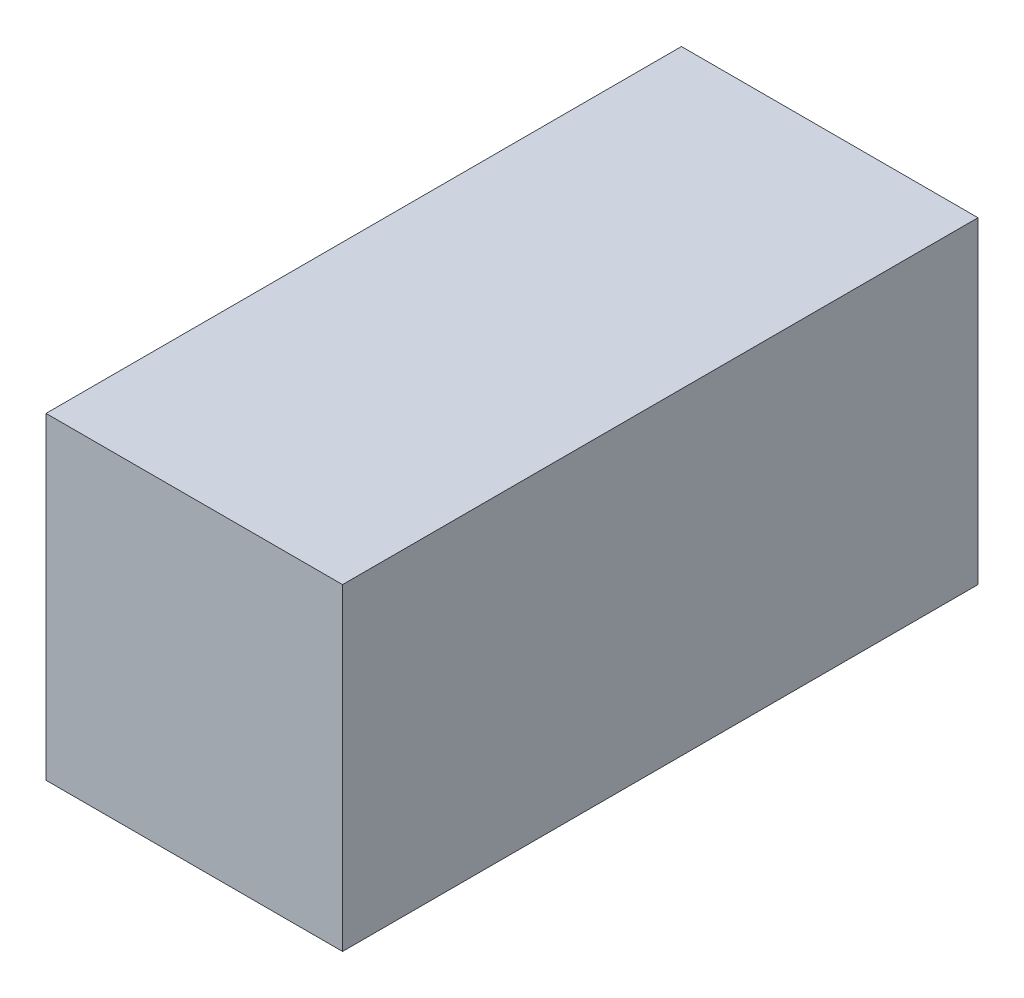
from build123d import *

# Parameters (mm, degrees)
STORE_KLAPE_KASET_KATI_DONMUS_KAP_4_1_START = -100
SKETCH1_W                                   = 140
SKETCH1_H                                   = 150
STORE_KLAPE_KASET_KATI_DONMUS_KAP_4_1_DEPTH = 300


with BuildPart() as part:
    # Sketch1 → STORE_klape_kaset_kati_donmus_kap_4_1 (new body)
    with BuildSketch(Plane.XY.offset(STORE_KLAPE_KASET_KATI_DONMUS_KAP_4_1_START)):
        with Locations((600, 480)):
            Rectangle(SKETCH1_W, SKETCH1_H)
    extrude(amount=-STORE_KLAPE_KASET_KATI_DONMUS_KAP_4_1_DEPTH)


solid = part.part
